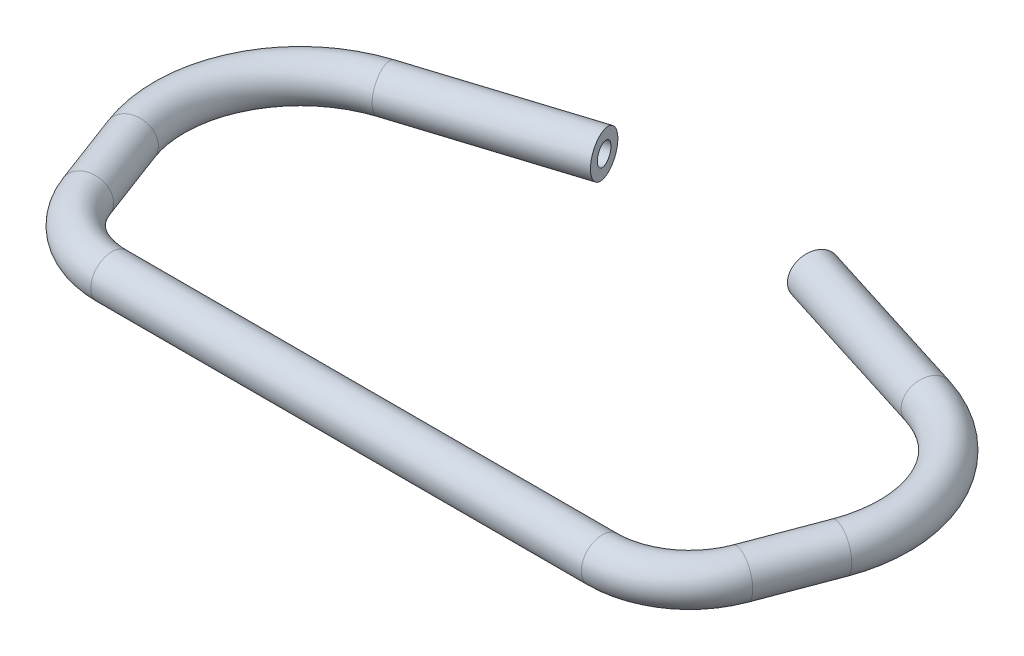
from build123d import *

# Parameters (mm, degrees)
SKETCH3_R   = 12
SKETCH3_R_2 = 6


with BuildPart() as part:
    # Sweep7: sweep along a path in Sketch2
    with BuildLine(Plane(origin=(0, 0, 0), x_dir=(1, 0, 0), z_dir=(0, 1, 0))) as sweep7_path:
        Line((-60, 201.498846579), (-155.052934963, 171.528771306))
        ThreePointArc((-155.052934963, 171.528771306), (-199.945167496, 132.804715841), (-202.693282775, 73.582145179))
        Line((-202.693282775, 73.582145179), (-187.189543002, 32.388096786))
        ThreePointArc((-187.189543002, 32.388096786), (-168.84929166, 8.886771224), (-140.394021152, 0))
        Line((-140.394021152, 0), (140.394021152, 0))
        ThreePointArc((140.394021152, 0), (168.84929166, 8.886771224), (187.189543002, 32.388096786))
        Line((187.189543002, 32.388096786), (202.693282775, 73.582145179))
        ThreePointArc((202.693282775, 73.582145179), (199.945167496, 132.804715841), (155.052934963, 171.528771306))
        Line((155.052934963, 171.528771306), (60, 201.498846579))
    # Sketch3 → Sweep7 (sweep)
    with BuildSketch(Plane(origin=(0, 0, 0), x_dir=(0, 0, -1), z_dir=(1, 0, 0))):
        Circle(SKETCH3_R)
        Circle(SKETCH3_R_2, mode=Mode.SUBTRACT)
    sweep(path=sweep7_path.line)


solid = part.part
